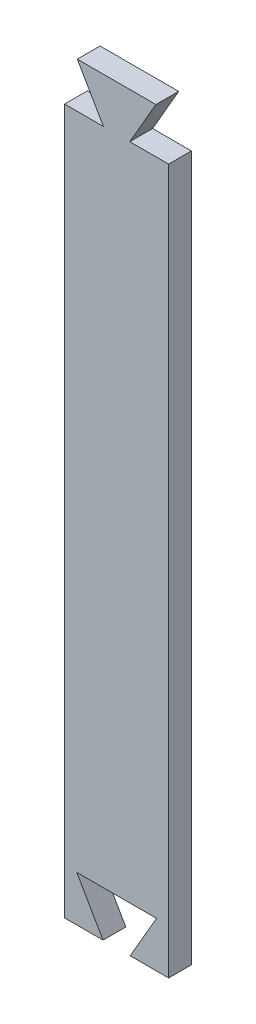
from build123d import *

# Parameters (mm, degrees)
BOSS_EXTRUDE1_DEPTH = 5.08


with BuildPart() as part:
    # Sketch1 → Boss-Extrude1 (new body)
    with BuildSketch(Plane.XY):
        Polygon((-3.024121265, 0), (-8.89, 10.16), (8.89, 10.16), (3.024121265, 0), (11.5976146, 0), (11.5976146, 157.1625), (2.941115356, 157.1625), (8.763, 167.2463), (-8.763, 167.2463), (-2.941115356, 157.1625), (-11.5976146, 157.1625), (-11.5976146, 0), align=None)
    extrude(amount=BOSS_EXTRUDE1_DEPTH)


solid = part.part
